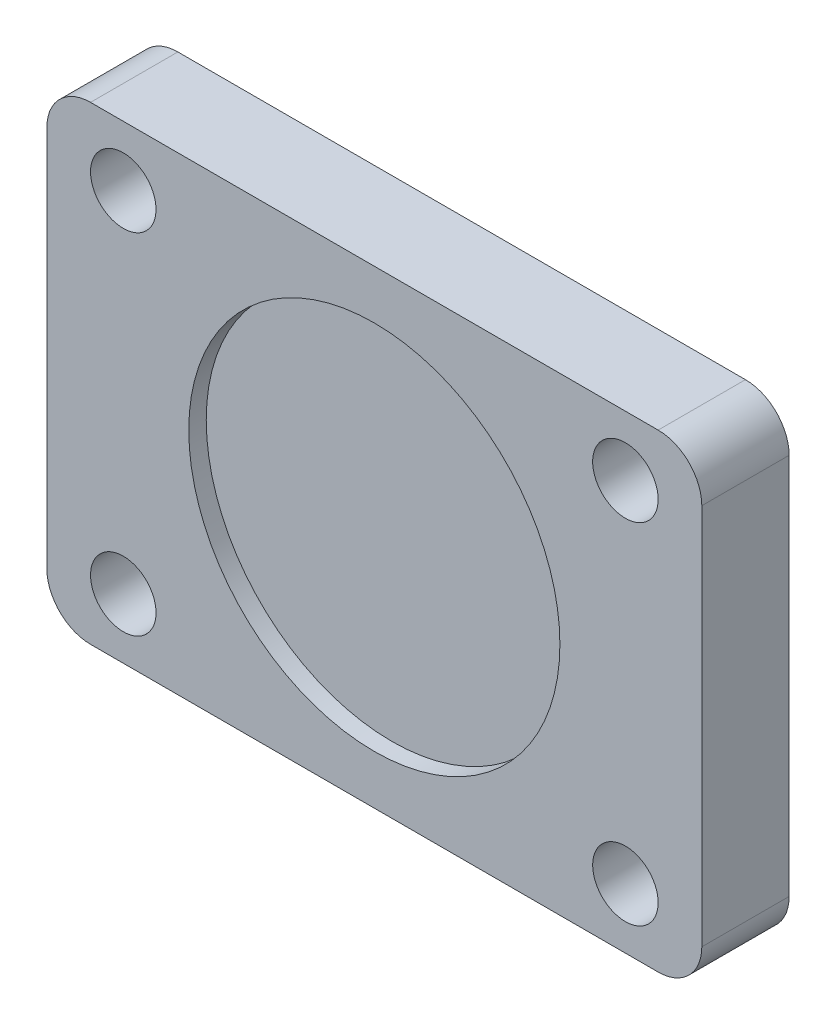
from build123d import *

# Parameters (mm, degrees)
SKETCH1_W           = 60
SKETCH1_H           = 43
SKETCH1_R           = 3
BOSS_EXTRUDE1_DEPTH = 8
FILLET1_R           = 4
SKETCH2_R           = 17
CUT_EXTRUDE1_DEPTH  = 1.6


with BuildPart() as part:
    # Sketch1 → Boss-Extrude1 (new body)
    with BuildSketch(Plane.XY):
        Rectangle(SKETCH1_W, SKETCH1_H)
        with Locations((23, 16)):
            Circle(SKETCH1_R, mode=Mode.SUBTRACT)
        with Locations(Location((23, -16, 0), (0, 0, 180))):
            Circle(SKETCH1_R, mode=Mode.SUBTRACT)
        with Locations((-23, -16)):
            Circle(SKETCH1_R, mode=Mode.SUBTRACT)
        with Locations(Location((-23, 16, 0), (0, 0, 180))):
            Circle(SKETCH1_R, mode=Mode.SUBTRACT)
    extrude(amount=BOSS_EXTRUDE1_DEPTH)

    # Fillet1
    fillet1_edges = [part.edges().sort_by_distance(p)[0] for p in [
        (30, -21.5, 4),
        (-30, -21.5, 4),
        (-30, 21.5, 4),
        (30, 21.5, 4),
    ]]
    fillet(fillet1_edges, radius=FILLET1_R)

    # Sketch2 → Cut-Extrude1 (cut)
    with BuildSketch(Plane.XY.offset(8)):
        Circle(SKETCH2_R)
    extrude(amount=-CUT_EXTRUDE1_DEPTH, mode=Mode.SUBTRACT)


solid = part.part
